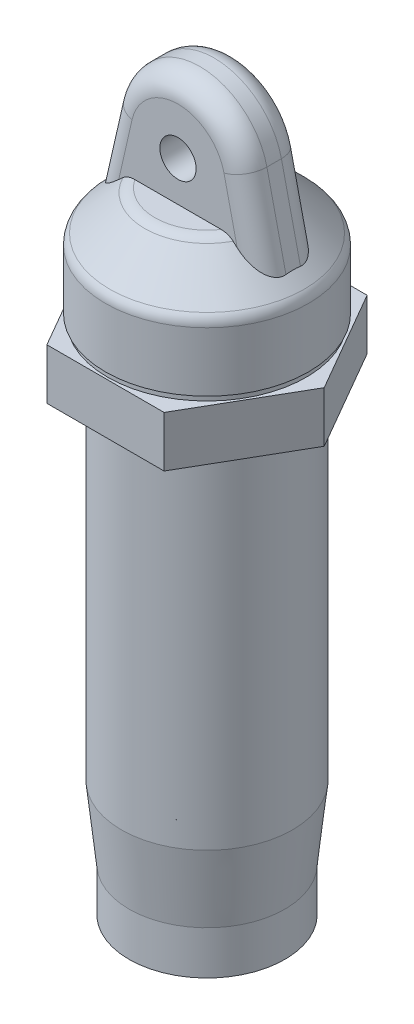
from build123d import *

# Parameters (mm, degrees)
SKETCH1_R                = 5.375
BOSS_EXTRUDE1_DEPTH      = 3
SKETCH2_R                = 5.375
BOSS_EXTRUDE2_DEPTH      = 5
BOSS_EXTRUDE2_DRAFT      = -6
SKETCH3_R                = 5.900521176
BOSS_EXTRUDE3_DEPTH      = 24
BOSS_EXTRUDE4_DEPTH      = 3.5
SKETCH6_R                = 6.846847864
BOSS_EXTRUDE5_DEPTH      = 0.396875
SKETCH7_R                = 7
BOSS_EXTRUDE6_DEPTH      = 4.5
SKETCH8_R                = 7
BOSS_EXTRUDE7_DEPTH      = 3
BOSS_EXTRUDE7_TAPER      = 45
BOSS_EXTRUDE8_DEPTH      = 2
BOSS_EXTRUDE8_DEPTH_BACK = 2
SKETCH9_R                = 4.75
SKETCH9_R_2              = 1.25
FILLET1_R                = 1
FILLET2_R                = 1.5
SKETCH10_R               = 1.5
CUT_EXTRUDE1_DEPTH       = 35.5


with BuildPart() as part:
    # Sketch1 → Boss-Extrude1 (new body)
    with BuildSketch(Plane(origin=(0, 0, 0), x_dir=(1, 0, 0), z_dir=(0, 1, 0))):
        with Locations(Location((0, 0, 0), (0, 0, 270))):
            Circle(SKETCH1_R)
    extrude(amount=BOSS_EXTRUDE1_DEPTH)


with BuildPart() as boss_extrude2_tool:
    # Sketch2 → Boss-Extrude2 (with draft: the straight prism first)
    with BuildSketch(Plane(origin=(0, 3, 0), x_dir=(1, 0, 0), z_dir=(0, 1, 0))):
        with Locations(Location((0, 0, 0), (0, 0, 270))):
            Circle(SKETCH2_R)
    extrude(amount=BOSS_EXTRUDE2_DEPTH)
    # Boss-Extrude2: the draft: its side faces are tilted about the plane it starts from
    boss_extrude2_sides = [boss_extrude2_tool.faces().sort_by_distance(p)[0] for p in [
        (0, 5.5, -5.375),
    ]]
    draft(boss_extrude2_sides, Plane(origin=(0, 3, 0), x_dir=(1, 0, 0), z_dir=(0, 1, 0)), BOSS_EXTRUDE2_DRAFT)


with BuildPart() as part_1:
    add(part.part)

    # Boss-Extrude2: add boss_extrude2_tool
    add(boss_extrude2_tool.part)

    # Sketch3 → Boss-Extrude3 (add)
    with BuildSketch(Plane(origin=(0, 8, 0), x_dir=(1, 0, 0), z_dir=(0, 1, 0))):
        with Locations(Location((0, 0, 0), (0, 0, 90))):
            Circle(SKETCH3_R)
    extrude(amount=BOSS_EXTRUDE3_DEPTH)

    # Sketch5 → Boss-Extrude4 (add)
    with BuildSketch(Plane(origin=(0, 32, 0), x_dir=(1, 0, 0), z_dir=(0, 1, 0))):
        Polygon((-4.041451884, 7), (-8.082903769, 0), (-4.041451884, -7), (4.041451884, -7), (8.082903769, 0), (4.041451884, 7), align=None)
    extrude(amount=BOSS_EXTRUDE4_DEPTH)

    # Sketch6 → Boss-Extrude5 (add)
    with BuildSketch(Plane(origin=(0, 35.5, 0), x_dir=(1, 0, 0), z_dir=(0, 1, 0))):
        with Locations(Location((0, 0, 0), (0, 0, 270))):
            Circle(SKETCH6_R)
    extrude(amount=BOSS_EXTRUDE5_DEPTH)

    # Sketch7 → Boss-Extrude6 (add)
    with BuildSketch(Plane(origin=(0, 35.896875, 0), x_dir=(1, 0, 0), z_dir=(0, 1, 0))):
        with Locations(Location((0, 0, 0), (0, 0, 270))):
            Circle(SKETCH7_R)
    extrude(amount=BOSS_EXTRUDE6_DEPTH)

    # Sketch8 → Boss-Extrude7 (add)
    with BuildSketch(Plane(origin=(0, 40.396875, 0), x_dir=(1, 0, 0), z_dir=(0, 1, 0))):
        with Locations(Location((0, 0, 0), (0, 0, 270))):
            Circle(SKETCH8_R)
    extrude(amount=BOSS_EXTRUDE7_DEPTH, taper=BOSS_EXTRUDE7_TAPER)

    # Sketch9 → Boss-Extrude8 (add, two sides: drawn at the far end of the back side and taken through both)
    # profile 1 of 2: a face of its own
    with BuildSketch(Plane.XY.offset(-BOSS_EXTRUDE8_DEPTH_BACK)):
        with Locations((0, 46.146875)):
            Circle(SKETCH9_R)
        with Locations((0, 46.146875)):
            Circle(SKETCH9_R_2, mode=Mode.SUBTRACT)
    # profile 2 of 2: a face of its own
    with BuildSketch(Plane.XY.offset(-BOSS_EXTRUDE8_DEPTH_BACK)):
        with BuildLine():
            Line((6.128092044, 40.623363897), (4.631634766, 47.200658372))
            ThreePointArc((4.631634766, 47.200658372), (4.72031594, 46.677080084), (4.75, 46.146875))
            ThreePointArc((4.75, 46.146875), (-0.530205084, 41.42655906), (-4.631634766, 47.200658372))
            Line((-4.631634766, 47.200658372), (-6.128092044, 40.623363897))
            Line((-6.128092044, 40.623363897), (6.128092044, 40.623363897))
        make_face()
    extrude(amount=BOSS_EXTRUDE8_DEPTH + BOSS_EXTRUDE8_DEPTH_BACK)

    # Fillet1
    fillet1_edges = [part_1.edges().sort_by_distance(p)[0] for p in [
        (2, 43.396875, 3.464101615),
        (0, 40.396875, -7),
        (0, 43.396875, -4),
    ]]
    fillet(fillet1_edges, radius=FILLET1_R)

    # Fillet2
    fillet2_edges = [part_1.edges().sort_by_distance(p)[0] for p in [
        (-5.332362658, 44.120788493, -2),
        (0, 50.896875, -2),
        (-5.332362658, 44.120788493, 2),
        (0, 50.896875, 2),
        (5.332362658, 44.120788493, -2),
        (5.332362658, 44.120788493, 2),
    ]]
    fillet(fillet2_edges, radius=FILLET2_R)

    # Sketch10 → Cut-Extrude1 (cut)
    with BuildSketch(Plane.XZ):
        with Locations(Location((0, 0, 0), (0, 0, 270))):
            Circle(SKETCH10_R)
    extrude(amount=-CUT_EXTRUDE1_DEPTH, mode=Mode.SUBTRACT)


solid = part_1.part
